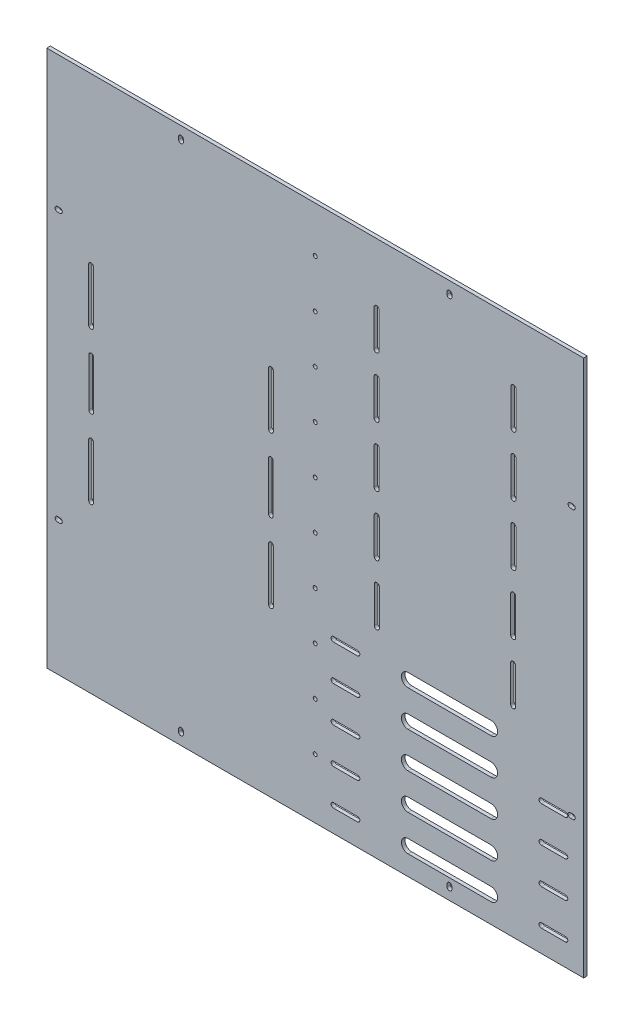
from build123d import *

# Parameters (mm, degrees)
SCHIZZO1_W                   = 448
SCHIZZO1_H                   = 448
SCHIZZO1_R                   = 1.65
ESTRUSIONE_ESTRUSIONE1_DEPTH = 3


with BuildPart() as part:
    # Schizzo1 → Estrusione-Estrusione1 (new body)
    with BuildSketch(Plane.XY):
        with Locations((224, 224)):
            Rectangle(SCHIZZO1_W, SCHIZZO1_H)
        with Locations((224, 49.77349824)):
            Circle(SCHIZZO1_R, mode=Mode.SUBTRACT)
        with Locations((224, 89.77349824)):
            Circle(SCHIZZO1_R, mode=Mode.SUBTRACT)
        with Locations((224, 129.77349824)):
            Circle(SCHIZZO1_R, mode=Mode.SUBTRACT)
        with Locations((224, 169.77349824)):
            Circle(SCHIZZO1_R, mode=Mode.SUBTRACT)
        with Locations((224, 209.77349824)):
            Circle(SCHIZZO1_R, mode=Mode.SUBTRACT)
        with Locations((224, 249.77349824)):
            Circle(SCHIZZO1_R, mode=Mode.SUBTRACT)
        with Locations((224, 289.77349824)):
            Circle(SCHIZZO1_R, mode=Mode.SUBTRACT)
        with Locations((224, 329.77349824)):
            Circle(SCHIZZO1_R, mode=Mode.SUBTRACT)
        with Locations((224, 369.77349824)):
            Circle(SCHIZZO1_R, mode=Mode.SUBTRACT)
        with Locations((224, 409.77349824)):
            Circle(SCHIZZO1_R, mode=Mode.SUBTRACT)
        with BuildLine():
            Line((9, 338), (11, 338))
            ThreePointArc((11, 338), (13, 336), (11, 334))
            Line((11, 334), (9, 334))
            ThreePointArc((9, 334), (7, 336), (9, 338))
        make_face(mode=Mode.SUBTRACT)
        with BuildLine():
            Line((9, 110), (11, 110))
            ThreePointArc((11, 110), (13, 112), (11, 114))
            Line((11, 114), (9, 114))
            ThreePointArc((9, 114), (7, 112), (9, 110))
        make_face(mode=Mode.SUBTRACT)
        with BuildLine():
            Line((439, 110), (437, 110))
            ThreePointArc((437, 110), (435, 112), (437, 114))
            Line((437, 114), (439, 114))
            ThreePointArc((439, 114), (441, 112), (439, 110))
        make_face(mode=Mode.SUBTRACT)
        with BuildLine():
            Line((439, 338), (437, 338))
            ThreePointArc((437, 338), (435, 336), (437, 334))
            Line((437, 334), (439, 334))
            ThreePointArc((439, 334), (441, 336), (439, 338))
        make_face(mode=Mode.SUBTRACT)
        with BuildLine():
            Line((114, 439), (114, 437))
            ThreePointArc((114, 437), (112, 435), (110, 437))
            Line((110, 437), (110, 439))
            ThreePointArc((110, 439), (112, 441), (114, 439))
        make_face(mode=Mode.SUBTRACT)
        with BuildLine():
            Line((334, 439), (334, 437))
            ThreePointArc((334, 437), (336, 435), (338, 437))
            Line((338, 437), (338, 439))
            ThreePointArc((338, 439), (336, 441), (334, 439))
        make_face(mode=Mode.SUBTRACT)
        with BuildLine():
            Line((114, 9), (114, 11))
            ThreePointArc((114, 11), (112, 13), (110, 11))
            Line((110, 11), (110, 9))
            ThreePointArc((110, 9), (112, 7), (114, 9))
        make_face(mode=Mode.SUBTRACT)
        with BuildLine():
            Line((334, 9), (334, 11))
            ThreePointArc((334, 11), (336, 13), (338, 11))
            Line((338, 11), (338, 9))
            ThreePointArc((338, 9), (336, 7), (334, 9))
        make_face(mode=Mode.SUBTRACT)
        with BuildLine():
            Line((34.958788995, 265.366145204), (34.958788995, 309.366145204))
            ThreePointArc((34.958788995, 309.366145204), (36.958788995, 311.366145204), (38.958788995, 309.366145204))
            Line((38.958788995, 309.366145204), (38.958788995, 265.366145204))
            ThreePointArc((38.958788995, 265.366145204), (36.958788995, 263.366145204), (34.958788995, 265.366145204))
        make_face(mode=Mode.SUBTRACT)
        with BuildLine():
            Line((34.958788995, 182.633854796), (34.958788995, 138.633854796))
            ThreePointArc((34.958788995, 138.633854796), (36.958788995, 136.633854796), (38.958788995, 138.633854796))
            Line((38.958788995, 138.633854796), (38.958788995, 182.633854796))
            ThreePointArc((38.958788995, 182.633854796), (36.958788995, 184.633854796), (34.958788995, 182.633854796))
        make_face(mode=Mode.SUBTRACT)
        with BuildLine():
            Line((35.086959829, 204.138830615), (35.086959829, 244.138830615))
            ThreePointArc((35.086959829, 244.138830615), (37.086959829, 246.138830615), (39.086959829, 244.138830615))
            Line((39.086959829, 244.138830615), (39.086959829, 204.138830615))
            ThreePointArc((39.086959829, 204.138830615), (37.086959829, 202.138830615), (35.086959829, 204.138830615))
        make_face(mode=Mode.SUBTRACT)
        with BuildLine():
            Line((189.041211005, 265.366145204), (189.041211005, 309.366145204))
            ThreePointArc((189.041211005, 309.366145204), (187.041211005, 311.366145204), (185.041211005, 309.366145204))
            Line((185.041211005, 309.366145204), (185.041211005, 265.366145204))
            ThreePointArc((185.041211005, 265.366145204), (187.041211005, 263.366145204), (189.041211005, 265.366145204))
        make_face(mode=Mode.SUBTRACT)
        with BuildLine():
            Line((188.913040171, 204.138830615), (188.913040171, 244.138830615))
            ThreePointArc((188.913040171, 244.138830615), (186.913040171, 246.138830615), (184.913040171, 244.138830615))
            Line((184.913040171, 244.138830615), (184.913040171, 204.138830615))
            ThreePointArc((184.913040171, 204.138830615), (186.913040171, 202.138830615), (188.913040171, 204.138830615))
        make_face(mode=Mode.SUBTRACT)
        with BuildLine():
            Line((189.041211005, 182.633854796), (189.041211005, 138.633854796))
            ThreePointArc((189.041211005, 138.633854796), (187.041211005, 136.633854796), (185.041211005, 138.633854796))
            Line((185.041211005, 138.633854796), (185.041211005, 182.633854796))
            ThreePointArc((185.041211005, 182.633854796), (187.041211005, 184.633854796), (189.041211005, 182.633854796))
        make_face(mode=Mode.SUBTRACT)
        with BuildLine():
            Line((239.25179704, 142.41111291), (259.25179704, 142.41111291))
            ThreePointArc((259.25179704, 142.41111291), (261.25179704, 140.41111291), (259.25179704, 138.41111291))
            Line((259.25179704, 138.41111291), (239.25179704, 138.41111291))
            ThreePointArc((239.25179704, 138.41111291), (237.25179704, 140.41111291), (239.25179704, 142.41111291))
        make_face(mode=Mode.SUBTRACT)
        with BuildLine():
            Line((239.25179704, 112.41111291), (259.25179704, 112.41111291))
            ThreePointArc((259.25179704, 112.41111291), (261.25179704, 110.41111291), (259.25179704, 108.41111291))
            Line((259.25179704, 108.41111291), (239.25179704, 108.41111291))
            ThreePointArc((239.25179704, 108.41111291), (237.25179704, 110.41111291), (239.25179704, 112.41111291))
        make_face(mode=Mode.SUBTRACT)
        with BuildLine():
            Line((239.25179704, 82.41111291), (259.25179704, 82.41111291))
            ThreePointArc((259.25179704, 82.41111291), (261.25179704, 80.41111291), (259.25179704, 78.41111291))
            Line((259.25179704, 78.41111291), (239.25179704, 78.41111291))
            ThreePointArc((239.25179704, 78.41111291), (237.25179704, 80.41111291), (239.25179704, 82.41111291))
        make_face(mode=Mode.SUBTRACT)
        with BuildLine():
            Line((239.25179704, 52.41111291), (259.25179704, 52.41111291))
            ThreePointArc((259.25179704, 52.41111291), (261.25179704, 50.41111291), (259.25179704, 48.41111291))
            Line((259.25179704, 48.41111291), (239.25179704, 48.41111291))
            ThreePointArc((239.25179704, 48.41111291), (237.25179704, 50.41111291), (239.25179704, 52.41111291))
        make_face(mode=Mode.SUBTRACT)
        with BuildLine():
            Line((370.696740904, 106.479629188), (301.474919265, 106.479629188))
            ThreePointArc((301.474919265, 106.479629188), (295.954548453, 112), (301.474919265, 117.520370812))
            Line((301.474919265, 117.520370812), (370.696740904, 117.520370812))
            ThreePointArc((370.696740904, 117.520370812), (376.217111716, 112), (370.696740904, 106.479629188))
        make_face(mode=Mode.SUBTRACT)
        with BuildLine():
            Line((370.696740904, 136.479629188), (301.474919265, 136.479629188))
            ThreePointArc((301.474919265, 136.479629188), (295.954548453, 142), (301.474919265, 147.520370812))
            Line((301.474919265, 147.520370812), (370.696740904, 147.520370812))
            ThreePointArc((370.696740904, 147.520370812), (376.217111716, 142), (370.696740904, 136.479629188))
        make_face(mode=Mode.SUBTRACT)
        with BuildLine():
            Line((370.696740904, 76.479629188), (301.474919265, 76.479629188))
            ThreePointArc((301.474919265, 76.479629188), (295.954548453, 82), (301.474919265, 87.520370812))
            Line((301.474919265, 87.520370812), (370.696740904, 87.520370812))
            ThreePointArc((370.696740904, 87.520370812), (376.217111716, 82), (370.696740904, 76.479629188))
        make_face(mode=Mode.SUBTRACT)
        with BuildLine():
            Line((273.310884325, 167.404265115), (273.310884325, 197.404265115))
            ThreePointArc((273.310884325, 197.404265115), (275.410884325, 199.504265115), (277.510884325, 197.404265115))
            Line((277.510884325, 197.404265115), (277.510884325, 167.404265115))
            ThreePointArc((277.510884325, 167.404265115), (275.410884325, 165.304265115), (273.310884325, 167.404265115))
        make_face(mode=Mode.SUBTRACT)
        with BuildLine():
            Line((273.243585861, 217.404219824), (273.243585861, 247.404219824))
            ThreePointArc((273.243585861, 247.404219824), (275.343585861, 249.504219824), (277.443585861, 247.404219824))
            Line((277.443585861, 247.404219824), (277.443585861, 217.404219824))
            ThreePointArc((277.443585861, 217.404219824), (275.343585861, 215.304219824), (273.243585861, 217.404219824))
        make_face(mode=Mode.SUBTRACT)
        with BuildLine():
            Line((273.176287397, 267.404174533), (273.176287397, 297.404174533))
            ThreePointArc((273.176287397, 297.404174533), (275.276287397, 299.504174533), (277.376287397, 297.404174533))
            Line((277.376287397, 297.404174533), (277.376287397, 267.404174533))
            ThreePointArc((277.376287397, 267.404174533), (275.276287397, 265.304174533), (273.176287397, 267.404174533))
        make_face(mode=Mode.SUBTRACT)
        with BuildLine():
            Line((273.108988933, 317.404129241), (273.108988933, 347.404129241))
            ThreePointArc((273.108988933, 347.404129241), (275.208988933, 349.504129241), (277.308988933, 347.404129241))
            Line((277.308988933, 347.404129241), (277.308988933, 317.404129241))
            ThreePointArc((277.308988933, 317.404129241), (275.208988933, 315.304129241), (273.108988933, 317.404129241))
        make_face(mode=Mode.SUBTRACT)
        with BuildLine():
            Line((273.041690469, 367.40408395), (273.041690469, 397.40408395))
            ThreePointArc((273.041690469, 397.40408395), (275.141690469, 399.50408395), (277.241690469, 397.40408395))
            Line((277.241690469, 397.40408395), (277.241690469, 367.40408395))
            ThreePointArc((277.241690469, 367.40408395), (275.141690469, 365.30408395), (273.041690469, 367.40408395))
        make_face(mode=Mode.SUBTRACT)
        with BuildLine():
            Line((391.248349465, 167.404265115), (391.248349465, 197.404265115))
            ThreePointArc((391.248349465, 197.404265115), (389.148349465, 199.504265115), (387.048349465, 197.404265115))
            Line((387.048349465, 197.404265115), (387.048349465, 167.404265115))
            ThreePointArc((387.048349465, 167.404265115), (389.148349465, 165.304265115), (391.248349465, 167.404265115))
        make_face(mode=Mode.SUBTRACT)
        with BuildLine():
            Line((391.315647929, 217.404219824), (391.315647929, 247.404219824))
            ThreePointArc((391.315647929, 247.404219824), (389.215647929, 249.504219824), (387.115647929, 247.404219824))
            Line((387.115647929, 247.404219824), (387.115647929, 217.404219824))
            ThreePointArc((387.115647929, 217.404219824), (389.215647929, 215.304219824), (391.315647929, 217.404219824))
        make_face(mode=Mode.SUBTRACT)
        with BuildLine():
            Line((391.382946393, 267.404174533), (391.382946393, 297.404174533))
            ThreePointArc((391.382946393, 297.404174533), (389.282946393, 299.504174533), (387.182946393, 297.404174533))
            Line((387.182946393, 297.404174533), (387.182946393, 267.404174533))
            ThreePointArc((387.182946393, 267.404174533), (389.282946393, 265.304174533), (391.382946393, 267.404174533))
        make_face(mode=Mode.SUBTRACT)
        with BuildLine():
            Line((391.450244857, 317.404129241), (391.450244857, 347.404129241))
            ThreePointArc((391.450244857, 347.404129241), (389.350244857, 349.504129241), (387.250244857, 347.404129241))
            Line((387.250244857, 347.404129241), (387.250244857, 317.404129241))
            ThreePointArc((387.250244857, 317.404129241), (389.350244857, 315.304129241), (391.450244857, 317.404129241))
        make_face(mode=Mode.SUBTRACT)
        with BuildLine():
            Line((391.517543321, 367.40408395), (391.517543321, 397.40408395))
            ThreePointArc((391.517543321, 397.40408395), (389.417543321, 399.50408395), (387.317543321, 397.40408395))
            Line((387.317543321, 397.40408395), (387.317543321, 367.40408395))
            ThreePointArc((387.317543321, 367.40408395), (389.417543321, 365.30408395), (391.517543321, 367.40408395))
        make_face(mode=Mode.SUBTRACT)
        with BuildLine():
            Line((239.25179704, 22.41111291), (259.25179704, 22.41111291))
            ThreePointArc((259.25179704, 22.41111291), (261.25179704, 20.41111291), (259.25179704, 18.41111291))
            Line((259.25179704, 18.41111291), (239.25179704, 18.41111291))
            ThreePointArc((239.25179704, 18.41111291), (237.25179704, 20.41111291), (239.25179704, 22.41111291))
        make_face(mode=Mode.SUBTRACT)
        with BuildLine():
            Line((432.765460802, 22.42975348), (412.765461173, 22.425900404))
            ThreePointArc((412.765461173, 22.425900404), (410.765846518, 20.425515134), (412.766231788, 18.425900478))
            Line((412.766231788, 18.425900478), (432.766231417, 18.429753554))
            ThreePointArc((432.766231417, 18.429753554), (434.765846072, 20.430138824), (432.765460802, 22.42975348))
        make_face(mode=Mode.SUBTRACT)
        with BuildLine():
            Line((432.759681189, 52.429752923), (412.75968156, 52.425899847))
            ThreePointArc((412.75968156, 52.425899847), (410.760066905, 50.425514577), (412.760452175, 48.425899922))
            Line((412.760452175, 48.425899922), (432.760451804, 48.429752997))
            ThreePointArc((432.760451804, 48.429752997), (434.760066459, 50.430138268), (432.759681189, 52.429752923))
        make_face(mode=Mode.SUBTRACT)
        with BuildLine():
            Line((432.753901575, 82.429752366), (412.753901947, 82.425899291))
            ThreePointArc((412.753901947, 82.425899291), (410.754287291, 80.42551402), (412.754672562, 78.425899365))
            Line((412.754672562, 78.425899365), (432.754672191, 78.42975244))
            ThreePointArc((432.754672191, 78.42975244), (434.754286846, 80.430137711), (432.753901575, 82.429752366))
        make_face(mode=Mode.SUBTRACT)
        with BuildLine():
            Line((432.748121962, 112.429751809), (412.748122333, 112.425898734))
            ThreePointArc((412.748122333, 112.425898734), (410.748507678, 110.425513463), (412.748892948, 108.425898808))
            Line((412.748892948, 108.425898808), (432.748892577, 108.429751884))
            ThreePointArc((432.748892577, 108.429751884), (434.748507233, 110.430137154), (432.748121962, 112.429751809))
        make_face(mode=Mode.SUBTRACT)
        with BuildLine():
            Line((370.696740904, 46.479629188), (301.474919265, 46.479629188))
            ThreePointArc((301.474919265, 46.479629188), (295.954548453, 52), (301.474919265, 57.520370812))
            Line((301.474919265, 57.520370812), (370.696740904, 57.520370812))
            ThreePointArc((370.696740904, 57.520370812), (376.217111716, 52), (370.696740904, 46.479629188))
        make_face(mode=Mode.SUBTRACT)
        with BuildLine():
            Line((370.696740904, 16.479629188), (301.474919265, 16.479629188))
            ThreePointArc((301.474919265, 16.479629188), (295.954548453, 22), (301.474919265, 27.520370812))
            Line((301.474919265, 27.520370812), (370.696740904, 27.520370812))
            ThreePointArc((370.696740904, 27.520370812), (376.217111716, 22), (370.696740904, 16.479629188))
        make_face(mode=Mode.SUBTRACT)
    extrude(amount=-ESTRUSIONE_ESTRUSIONE1_DEPTH)


solid = part.part
